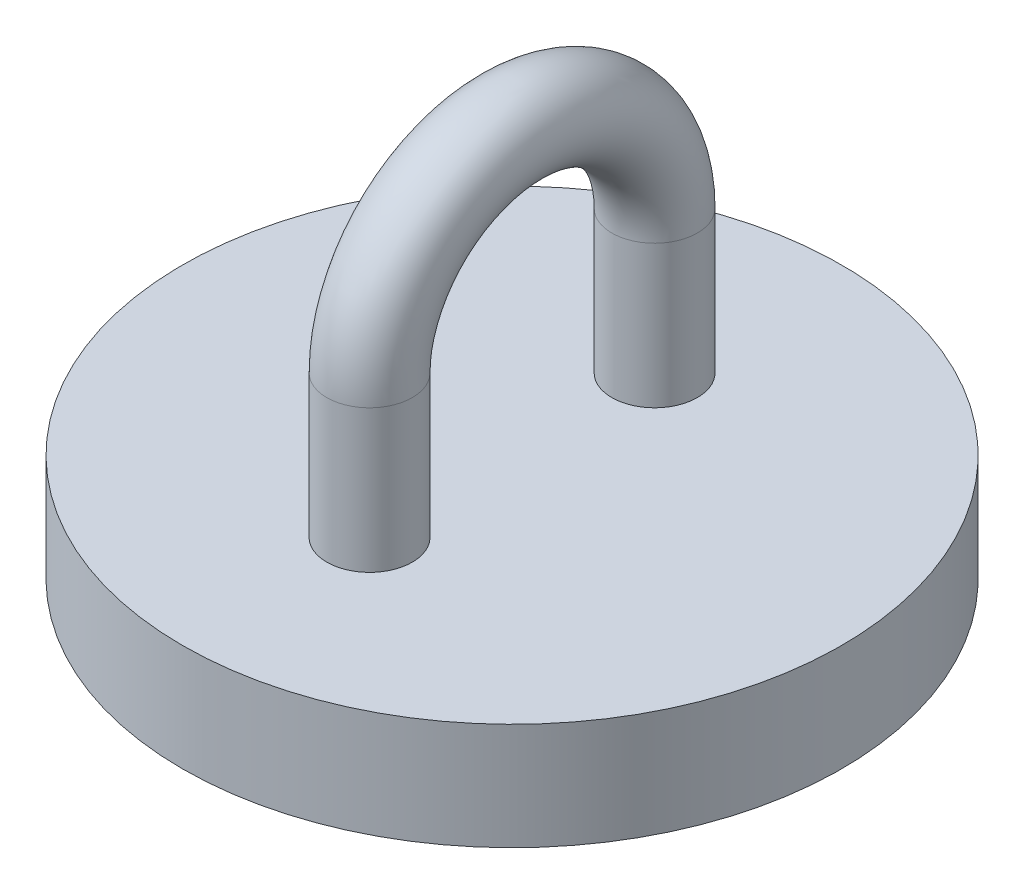
from build123d import *

# Parameters (mm, degrees)
SKETCH1_R           = 9.25
BOSS_EXTRUDE1_DEPTH = 3
SKETCH2_R           = 1.2


with BuildPart() as part:
    # Sketch1 → Boss-Extrude1 (new body)
    with BuildSketch(Plane(origin=(0, 0, 0), x_dir=(1, 0, 0), z_dir=(0, 1, 0))):
        with Locations(Location((0, 0, 0), (0, 0, 270))):
            Circle(SKETCH1_R)
    extrude(amount=BOSS_EXTRUDE1_DEPTH)

    # Sweep1: sweep along a path in Sketch3
    with BuildLine(Plane(origin=(0, 0, 0), x_dir=(0, 0, -1), z_dir=(1, 0, 0))) as sweep1_path:
        Line((-4, 3), (-4, 7))
        ThreePointArc((-4, 7), (0, 11), (4, 7))
        Line((4, 7), (4, 3))
    # Sketch2 → Sweep1 (sweep)
    with BuildSketch(Plane(origin=(0, 3, 0), x_dir=(1, 0, 0), z_dir=(0, 1, 0))):
        with Locations((0, -4)):
            Circle(SKETCH2_R)
    sweep(path=sweep1_path.line)


solid = part.part
